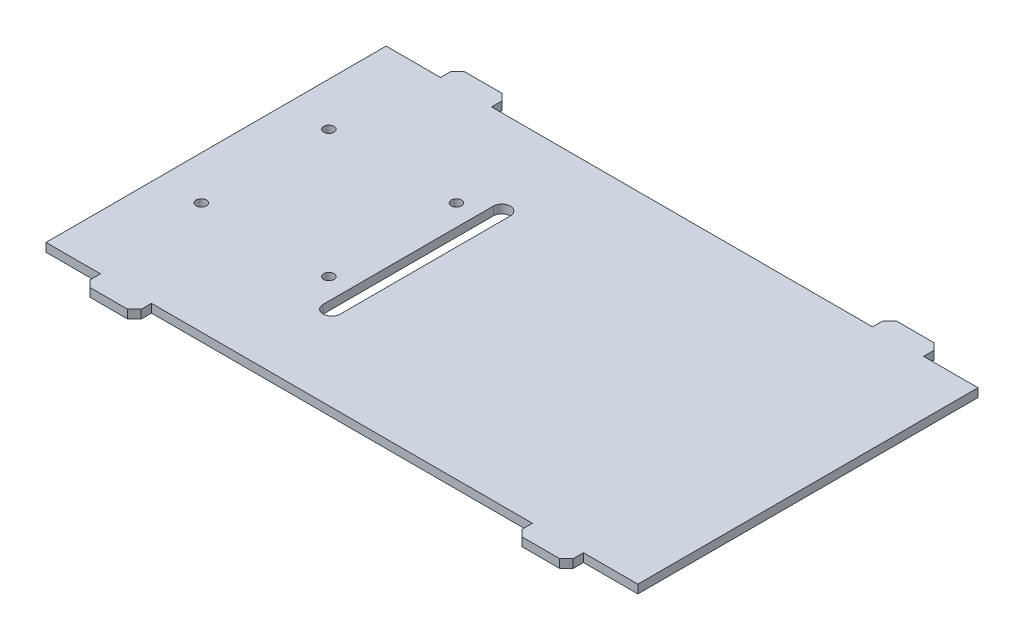
from build123d import *

# Parameters (mm, degrees)
SKETCH1_W           = 174
SKETCH1_H           = 100
BOSS_EXTRUDE1_DEPTH = 2.5
SKETCH2_W           = 15
SKETCH2_H           = 2.5
BOSS_EXTRUDE2_DEPTH = 5
CHAMFER1_SIZE       = 2


with BuildPart() as part:
    # Sketch1 → Boss-Extrude1 (new body)
    with BuildSketch(Plane(origin=(0, 0, 0), x_dir=(1, 0, 0), z_dir=(0, 1, 0))):
        Rectangle(SKETCH1_W, SKETCH1_H)
        with BuildLine():
            Line((-25.5, 25), (-25.5, -25))
            ThreePointArc((-25.5, -25), (-28, -27.5), (-30.5, -25))
            Line((-30.5, -25), (-30.5, 25))
            ThreePointArc((-30.5, 25), (-28, 27.5), (-25.5, 25))
        make_face(mode=Mode.SUBTRACT)
        with BuildLine():
            ThreePointArc((-36.73295862, -15.609359563), (-38.23295862, -17.109359563), (-36.73295862, -18.609359563))
            ThreePointArc((-36.73295862, -18.609359563), (-35.23295862, -17.109359563), (-36.73295862, -15.609359563))
        make_face(mode=Mode.SUBTRACT)
        with BuildLine():
            ThreePointArc((-36.73295862, 18.890640437), (-35.23295862, 20.390640437), (-36.73295862, 21.890640437))
            ThreePointArc((-36.73295862, 21.890640437), (-38.23295862, 20.390640437), (-36.73295862, 18.890640437))
        make_face(mode=Mode.SUBTRACT)
        with BuildLine():
            ThreePointArc((-74.23295862, 21.890640437), (-75.73295862, 20.390640437), (-74.23295862, 18.890640437))
            ThreePointArc((-74.23295862, 18.890640437), (-72.73295862, 20.390640437), (-74.23295862, 21.890640437))
        make_face(mode=Mode.SUBTRACT)
        with BuildLine():
            ThreePointArc((-74.23295862, -15.609359563), (-75.73295862, -17.109359563), (-74.23295862, -18.609359563))
            ThreePointArc((-74.23295862, -18.609359563), (-72.73295862, -17.109359563), (-74.23295862, -15.609359563))
        make_face(mode=Mode.SUBTRACT)
    extrude(amount=BOSS_EXTRUDE1_DEPTH)

    # Sketch2 → Boss-Extrude2 (add)
    with BuildSketch(Plane.XY.offset(50)):
        with Locations((-63.5, 1.25)):
            Rectangle(SKETCH2_W, SKETCH2_H)
        with Locations((63.5, 1.25)):
            Rectangle(SKETCH2_W, SKETCH2_H)
    boss_extrude2 = extrude(amount=BOSS_EXTRUDE2_DEPTH)

    # Mirror1: Boss-Extrude2 across plane
    add(boss_extrude2.mirror(Plane.XY))

    # Chamfer1
    chamfer1_edges = [part.edges().sort_by_distance(p)[0] for p in [
        (-71, 1.25, 55),
        (-56, 1.25, 55),
        (56, 1.25, 55),
        (71, 1.25, 55),
        (-56, 1.25, -55),
        (-71, 1.25, -55),
        (71, 1.25, -55),
        (56, 1.25, -55),
    ]]
    chamfer(chamfer1_edges, length=CHAMFER1_SIZE)


solid = part.part
